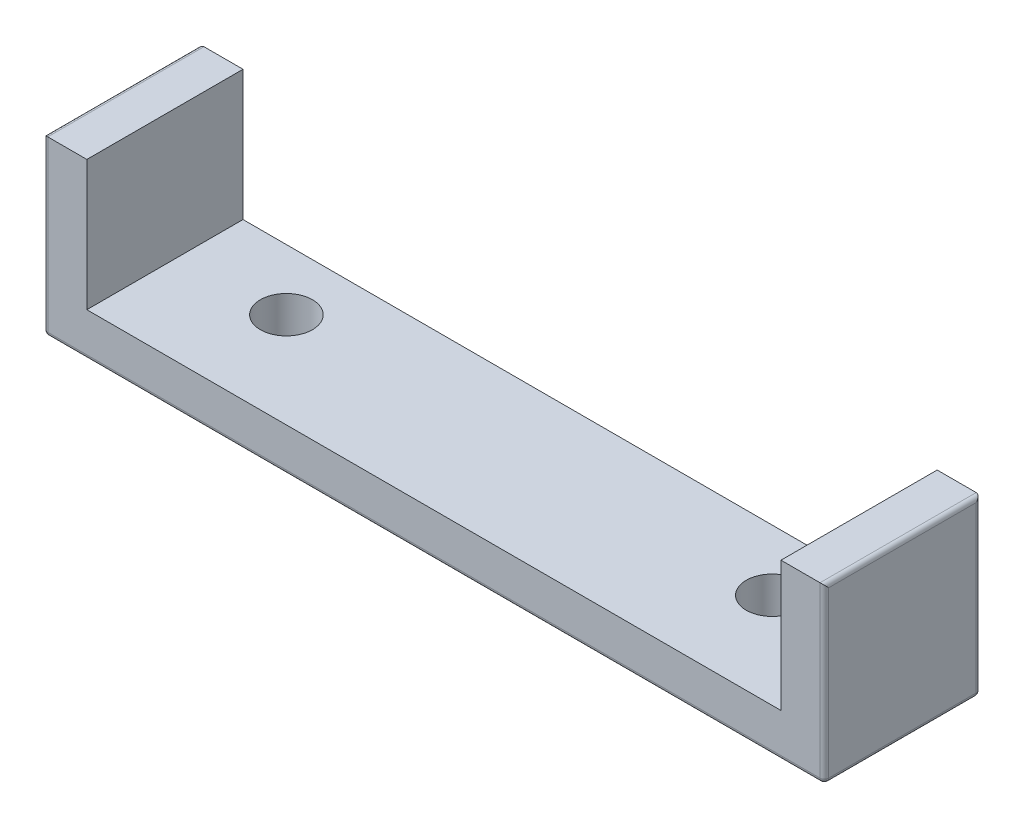
from build123d import *

# Parameters (mm, degrees)
SKETCH1_W           = 80
SKETCH1_H           = 18
SKETCH1_R           = 3
BOSS_EXTRUDE1_DEPTH = 5
SKETCH1_6_W         = 5
SKETCH1_6_H         = 18
BOSS_EXTRUDE2_DEPTH = 20
FILLET1_R           = 0.5


with BuildPart() as part:
    # Sketch1 → Boss-Extrude1 (new body)
    with BuildSketch(Plane(origin=(0, 0, 0), x_dir=(1, 0, 0), z_dir=(0, 1, 0))):
        with Locations((102.5033, -9)):
            Rectangle(SKETCH1_W, SKETCH1_H)
        with Locations((74.5033, -7)):
            Circle(SKETCH1_R, mode=Mode.SUBTRACT)
        with Locations((130.5033, -7)):
            Circle(SKETCH1_R, mode=Mode.SUBTRACT)
    extrude(amount=BOSS_EXTRUDE1_DEPTH)

    # Sketch1<6> → Boss-Extrude2 (add)
    with BuildSketch(Plane(origin=(0, 0, 0), x_dir=(1, 0, 0), z_dir=(0, 1, 0))):
        with Locations((145.0033, -9)):
            Rectangle(SKETCH1_6_W, SKETCH1_6_H)
        with Locations((60.0033, -9)):
            Rectangle(SKETCH1_6_W, SKETCH1_6_H)
    extrude(amount=BOSS_EXTRUDE2_DEPTH)

    # Fillet1
    fillet1_edges = [part.edges().sort_by_distance(p)[0] for p in [
        (57.5033, 10, 0),
        (57.5033, 20, 9),
        (57.5033, 10, 18),
        (57.5033, 0, 9),
        (102.5033, 0, 18),
        (102.5033, 0, 0),
        (71.5033, 0, 7),
        (127.5033, 0, 7),
        (147.5033, 10, 18),
        (147.5033, 20, 9),
        (147.5033, 10, 0),
        (147.5033, 0, 9),
    ]]
    fillet(fillet1_edges, radius=FILLET1_R)


solid = part.part
